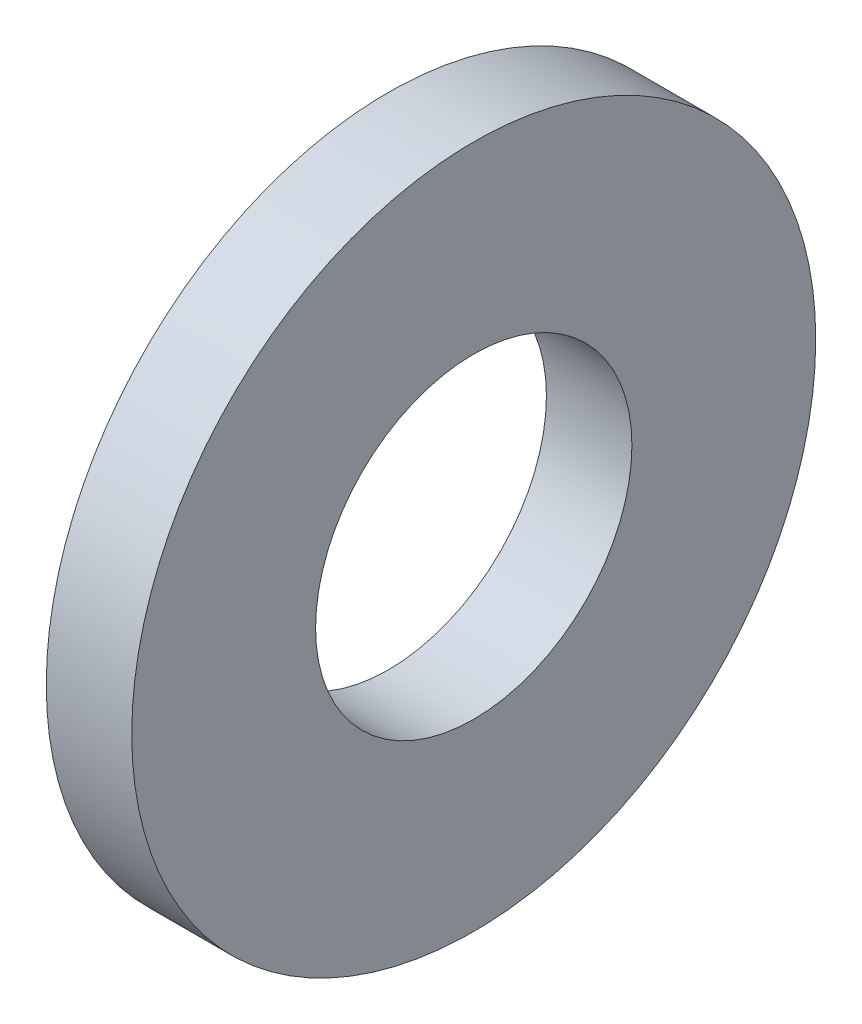
from build123d import *

# Parameters (mm, degrees)
SKETCH1_R          = 8
SKETCH1_R_2        = 3.7
BASE_EXTRUDE_DEPTH = 2


with BuildPart() as part:
    # Sketch1 → Base-Extrude (new body)
    with BuildSketch(Plane(origin=(0, 0, 0), x_dir=(0, 0, -1), z_dir=(1, 0, 0))):
        Circle(SKETCH1_R)
        Circle(SKETCH1_R_2, mode=Mode.SUBTRACT)
    extrude(amount=BASE_EXTRUDE_DEPTH)


solid = part.part
